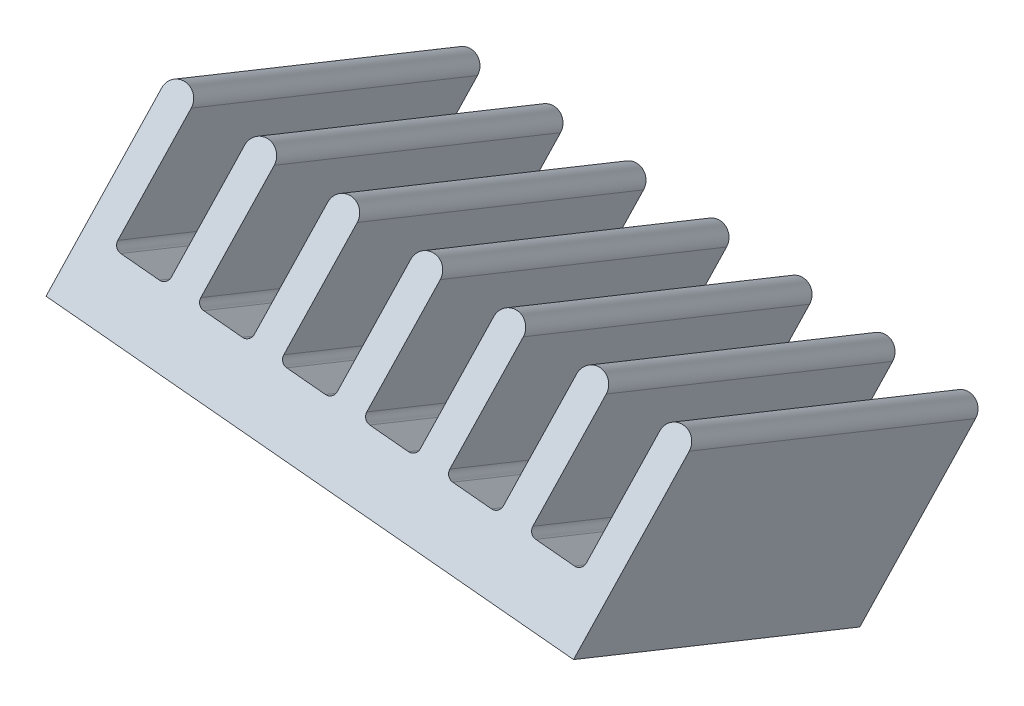
from build123d import *

# Parameters (mm, degrees)
SKETCH2_W           = 14.3
SKETCH2_H           = 14.3
BOSS_EXTRUDE1_DEPTH = 5.6
CUT_EXTRUDE2_DEPTH  = 17.5
LPATTERN1_COUNT     = 5
LPATTERN1_PITCH     = 2.25
LPATTERN1_COL_COUNT = 4
LPATTERN1_COL_PITCH = 2.25


with BuildPart() as part:
    # Sketch2 → Boss-Extrude1 (new body)
    with BuildSketch(Plane(origin=(-2.586863131, -15.699309697, 9.787522701), x_dir=(0.9597170343404154, -0.24447167145746004, -0.13848038074627608), z_dir=(0.13848038074627628, 0.8404180176603395, -0.5239472680912))):
        with Locations((20.198681335, -0.426078635)):
            Rectangle(SKETCH2_W, SKETCH2_H)
    extrude(amount=BOSS_EXTRUDE1_DEPTH)

    # Sketch3 → Cut-Extrude2 (cut)
    with BuildSketch(Plane(origin=(-1.643808295, -3.252120737, -5.650904665), x_dir=(-0.9696564349576585, 0.12194238719709705, 0.21188782964077374), z_dir=(-0.24447167145746004, -0.4836643024316157, -0.8404180176603393))):
        with BuildLine():
            Line((-17.670554194, -16.169704918), (-17.199268448, -19.435878481))
            ThreePointArc((-17.199268448, -19.435878481), (-17.121093331, -19.567484364), (-16.972755762, -19.605265621))
            Line((-16.972755762, -19.605265621), (-15.93351872, -19.455311066))
            ThreePointArc((-15.93351872, -19.455311066), (-15.801912836, -19.377135948), (-15.764131579, -19.22879838))
            Line((-15.764131579, -19.22879838), (-16.235417325, -15.962624817))
            ThreePointArc((-16.235417325, -15.962624817), (-16.159854811, -15.665949681), (-15.896643044, -15.509599446))
            Line((-15.896643044, -15.509599446), (-18.123579565, -15.830930637))
            ThreePointArc((-18.123579565, -15.830930637), (-17.826904429, -15.906493151), (-17.670554194, -16.169704918))
        make_face()
    cut_extrude2 = extrude(amount=-CUT_EXTRUDE2_DEPTH, mode=Mode.SUBTRACT)

    # LPattern1: Cut-Extrude2 ×5
    with Locations(*[Vector(0.9597170343404154, -0.24447167145746015, -0.138480380746276) * (i * LPATTERN1_PITCH) for i in range(1, LPATTERN1_COUNT)]):
        add(cut_extrude2, mode=Mode.SUBTRACT)

    # LPattern1 col: Cut-Extrude2 ×4
    with Locations(*[Vector(-0.9597170343404154, 0.2444716714574598, 0.13848038074627622) * (i * LPATTERN1_COL_PITCH) for i in range(1, LPATTERN1_COL_COUNT)]):
        add(cut_extrude2, mode=Mode.SUBTRACT)


solid = part.part
